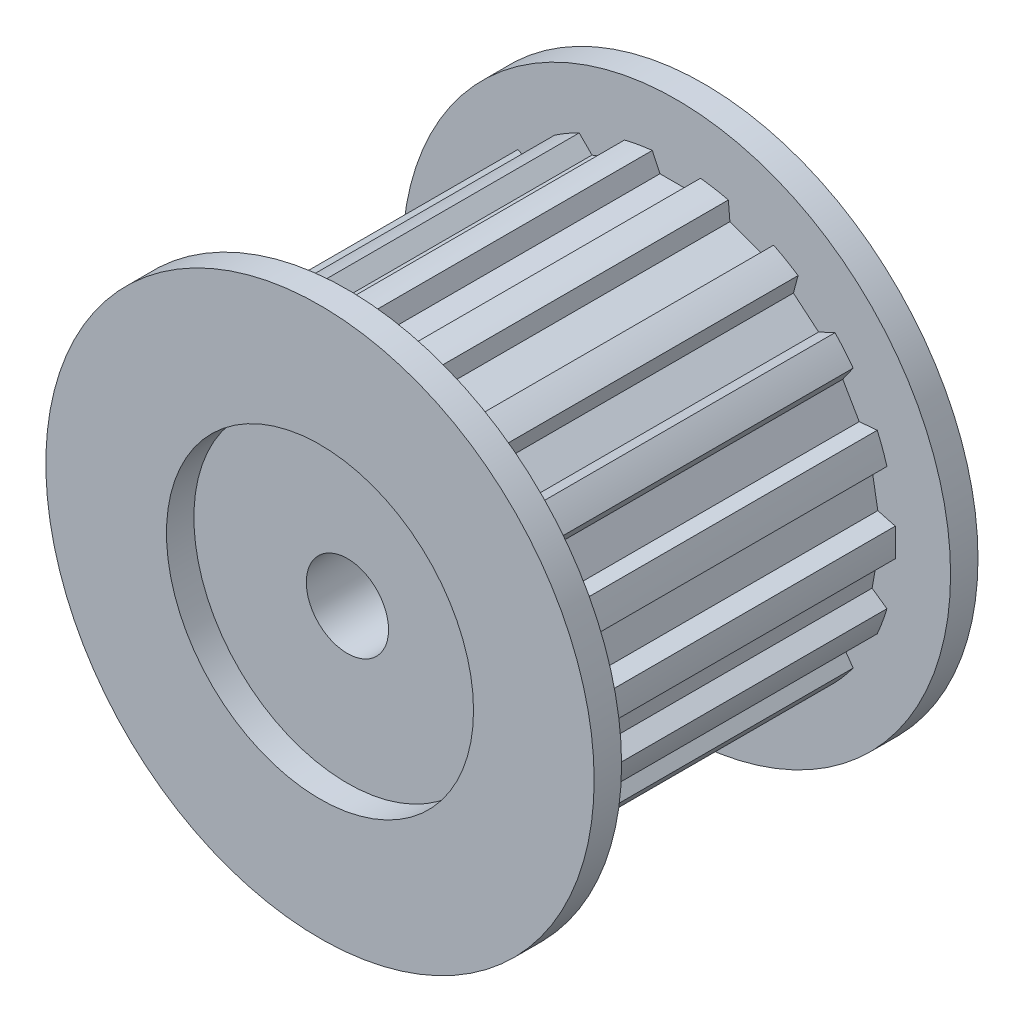
from build123d import *

# Parameters (mm, degrees)
ESQUISSE1_R                  = 8
ESQUISSE1_R_2                = 1.5
EXTRUSION1_DEPTH             = 12
EXTRUSION2_DEPTH             = 17.492422502
R_P_TITION_CIRCULAIRE1_COUNT = 18
ESQUISSE3_R                  = 10
ESQUISSE3_R_2                = 5.6
EXTRUSION3_DEPTH             = 1
R_P_TITION_LIN_AIRE1_COUNT   = 2
R_P_TITION_LIN_AIRE1_PITCH   = 13


with BuildPart() as part:
    # Esquisse1 → Extrusion1 (new body)
    with BuildSketch(Plane.XY):
        Circle(ESQUISSE1_R)
        Circle(ESQUISSE1_R_2, mode=Mode.SUBTRACT)
    extrude(amount=EXTRUSION1_DEPTH)

    # Esquisse2 → Extrusion2 (cut, through all)
    with BuildSketch(Plane.XY.offset(12)):
        Polygon((-0.6, 7.353512063), (0.6, 7.353512063), (1.002277566, 8.216199086), (-1.002277566, 8.216199086), align=None)
    extrusion2 = extrude(amount=-EXTRUSION2_DEPTH, mode=Mode.SUBTRACT)

    # Répétition circulaire1: Extrusion2 ×18 about axis
    r_p_tition_circulaire1_axis = Axis((0, 0, 0), (0, 0, 1))
    for i in range(1, R_P_TITION_CIRCULAIRE1_COUNT):
        add(extrusion2.rotate(r_p_tition_circulaire1_axis, i * 360 / R_P_TITION_CIRCULAIRE1_COUNT), mode=Mode.SUBTRACT)

    # Esquisse3 → Extrusion3 (add)
    with BuildSketch(Plane.XY.offset(12)):
        Circle(ESQUISSE3_R)
        Circle(ESQUISSE3_R_2, mode=Mode.SUBTRACT)
    extrusion3 = extrude(amount=EXTRUSION3_DEPTH)

    # Répétition linéaire1: Extrusion3 ×2
    with Locations(*[(0, 0, -i * R_P_TITION_LIN_AIRE1_PITCH) for i in range(1, R_P_TITION_LIN_AIRE1_COUNT)]):
        add(extrusion3)


solid = part.part
